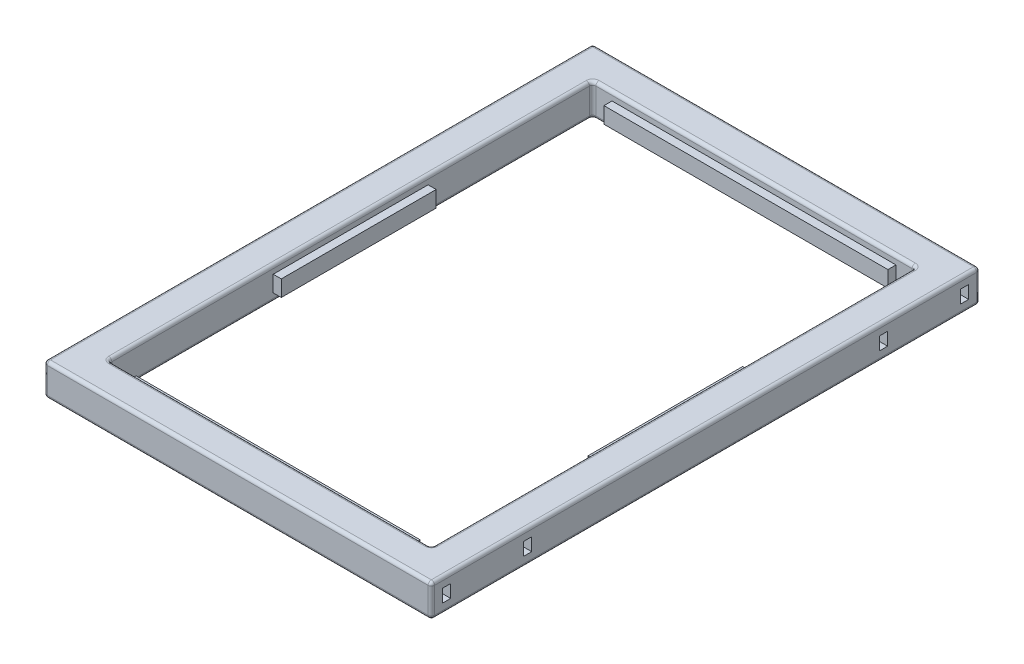
from build123d import *

# Parameters (mm, degrees)
SKETCH1_W           = 240
SKETCH1_H           = 340
BOSS_EXTRUDE1_DEPTH = 20
SKETCH2_W           = 200
SKETCH2_H           = 300
CUT_EXTRUDE1_DEPTH  = 288.524209706
SKETCH3_W           = 96
SKETCH3_H           = 10
BOSS_EXTRUDE2_DEPTH = 5
SKETCH4_W           = 96
SKETCH4_H           = 10
BOSS_EXTRUDE3_DEPTH = 5
SKETCH5_W           = 176
SKETCH5_H           = 10
BOSS_EXTRUDE4_DEPTH = 5
SKETCH6_W           = 176
SKETCH6_H           = 10
BOSS_EXTRUDE5_DEPTH = 5
SKETCH7_W           = 5
SKETCH7_H           = 8
CUT_EXTRUDE2_DEPTH  = 10
SKETCH8_W           = 5
SKETCH8_H           = 8
CUT_EXTRUDE3_DEPTH  = 10
SKETCH9_W           = 5
SKETCH9_H           = 8
CUT_EXTRUDE4_DEPTH  = 10
SKETCH10_W          = 5
SKETCH10_H          = 8
CUT_EXTRUDE5_DEPTH  = 10
SKETCH11_W          = 5
SKETCH11_H          = 8
CUT_EXTRUDE6_DEPTH  = 10
SKETCH12_W          = 5
SKETCH12_H          = 8
CUT_EXTRUDE7_DEPTH  = 10
SKETCH13_W          = 5
SKETCH13_H          = 8
CUT_EXTRUDE8_DEPTH  = 10
SKETCH14_W          = 5
SKETCH14_H          = 8
CUT_EXTRUDE9_DEPTH  = 10
FILLET1_R           = 2


with BuildPart() as part:
    # Sketch1 → Boss-Extrude1 (new body)
    with BuildSketch(Plane.XZ):
        with Locations((-5.61688401, 87.857653791)):
            Rectangle(SKETCH1_W, SKETCH1_H)
    extrude(amount=-BOSS_EXTRUDE1_DEPTH)

    # Sketch2 → Cut-Extrude1 (cut, through all)
    with BuildSketch(Plane(origin=(0, 20, 0), x_dir=(-1, 0, 0), z_dir=(0, 1, 0))):
        with Locations((5.61688401, 87.857653791)):
            Rectangle(SKETCH2_W, SKETCH2_H)
    extrude(amount=-CUT_EXTRUDE1_DEPTH, mode=Mode.SUBTRACT)

    # Sketch3 → Boss-Extrude2 (add)
    with BuildSketch(Plane(origin=(-105.61688401, 0, 0), x_dir=(0, 0, -1), z_dir=(1, 0, 0))):
        with Locations((-87.857653791, 10)):
            Rectangle(SKETCH3_W, SKETCH3_H)
    extrude(amount=BOSS_EXTRUDE2_DEPTH)

    # Sketch4 → Boss-Extrude3 (add)
    with BuildSketch(Plane.ZY.offset(-94.38311599)):
        with Locations((87.857653791, 10)):
            Rectangle(SKETCH4_W, SKETCH4_H)
    extrude(amount=BOSS_EXTRUDE3_DEPTH)

    # Sketch5 → Boss-Extrude4 (add)
    with BuildSketch(Plane(origin=(0, 0, 237.857653791), x_dir=(-1, 0, 0), z_dir=(0, 0, -1))):
        with Locations((5.61688401, 10)):
            Rectangle(SKETCH5_W, SKETCH5_H)
    extrude(amount=BOSS_EXTRUDE4_DEPTH)

    # Sketch6 → Boss-Extrude5 (add)
    with BuildSketch(Plane.XY.offset(-62.142346209)):
        with Locations((-5.61688401, 10)):
            Rectangle(SKETCH6_W, SKETCH6_H)
    extrude(amount=BOSS_EXTRUDE5_DEPTH)

    # Sketch7 → Cut-Extrude2 (cut)
    with BuildSketch(Plane(origin=(114.38311599, 0, 0), x_dir=(0, 0, -1), z_dir=(1, 0, 0))):
        with Locations((-248.357653791, 10)):
            Rectangle(SKETCH7_W, SKETCH7_H)
    extrude(amount=-CUT_EXTRUDE2_DEPTH, mode=Mode.SUBTRACT)

    # Sketch8 → Cut-Extrude3 (cut)
    with BuildSketch(Plane(origin=(114.38311599, 0, 0), x_dir=(0, 0, -1), z_dir=(1, 0, 0))):
        with Locations((-198.157653791, 10)):
            Rectangle(SKETCH8_W, SKETCH8_H)
    extrude(amount=-CUT_EXTRUDE3_DEPTH, mode=Mode.SUBTRACT)

    # Sketch9 → Cut-Extrude4 (cut)
    with BuildSketch(Plane(origin=(114.38311599, 0, 0), x_dir=(0, 0, -1), z_dir=(1, 0, 0))):
        with Locations((22.442346209, 10)):
            Rectangle(SKETCH9_W, SKETCH9_H)
    extrude(amount=-CUT_EXTRUDE4_DEPTH, mode=Mode.SUBTRACT)

    # Sketch10 → Cut-Extrude5 (cut)
    with BuildSketch(Plane(origin=(114.38311599, 0, 0), x_dir=(0, 0, -1), z_dir=(1, 0, 0))):
        with Locations((72.642346209, 10)):
            Rectangle(SKETCH10_W, SKETCH10_H)
    extrude(amount=-CUT_EXTRUDE5_DEPTH, mode=Mode.SUBTRACT)

    # Sketch11 → Cut-Extrude6 (cut)
    with BuildSketch(Plane.ZY.offset(125.61688401)):
        with Locations((248.357653791, 10)):
            Rectangle(SKETCH11_W, SKETCH11_H)
    extrude(amount=-CUT_EXTRUDE6_DEPTH, mode=Mode.SUBTRACT)

    # Sketch12 → Cut-Extrude7 (cut)
    with BuildSketch(Plane.ZY.offset(125.61688401)):
        with Locations((198.157653791, 10)):
            Rectangle(SKETCH12_W, SKETCH12_H)
    extrude(amount=-CUT_EXTRUDE7_DEPTH, mode=Mode.SUBTRACT)

    # Sketch13 → Cut-Extrude8 (cut)
    with BuildSketch(Plane.ZY.offset(125.61688401)):
        with Locations((-22.442346209, 10)):
            Rectangle(SKETCH13_W, SKETCH13_H)
    extrude(amount=-CUT_EXTRUDE8_DEPTH, mode=Mode.SUBTRACT)

    # Sketch14 → Cut-Extrude9 (cut)
    with BuildSketch(Plane.ZY.offset(125.61688401)):
        with Locations((-72.642346209, 10)):
            Rectangle(SKETCH14_W, SKETCH14_H)
    extrude(amount=-CUT_EXTRUDE9_DEPTH, mode=Mode.SUBTRACT)

    # Fillet1
    fillet1_edges = [part.edges().sort_by_distance(p)[0] for p in [
        (-5.61688401, 20, 257.857653791),
        (-125.61688401, 20, 87.857653791),
        (-5.61688401, 0, 237.857653791),
        (94.38311599, 10, 237.857653791),
        (-105.61688401, 0, 87.857653791),
        (-105.61688401, 10, 237.857653791),
        (-5.61688401, 0, -62.142346209),
        (-105.61688401, 10, -62.142346209),
        (94.38311599, 0, 87.857653791),
        (94.38311599, 10, -62.142346209),
        (-5.61688401, 20, 237.857653791),
        (94.38311599, 20, 87.857653791),
        (-5.61688401, 20, -62.142346209),
        (-105.61688401, 20, 87.857653791),
        (-5.61688401, 20, -82.142346209),
        (-125.61688401, 0, 87.857653791),
        (-5.61688401, 0, 257.857653791),
        (114.38311599, 0, 87.857653791),
        (-5.61688401, 0, -82.142346209),
        (-125.61688401, 10, -82.142346209),
        (-125.61688401, 10, 257.857653791),
        (114.38311599, 10, 257.857653791),
        (114.38311599, 10, -82.142346209),
        (114.38311599, 20, 87.857653791),
    ]]
    fillet(fillet1_edges, radius=FILLET1_R)


solid = part.part
